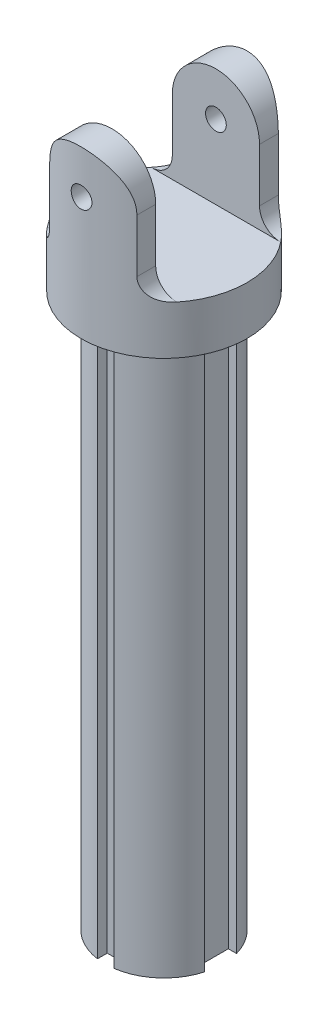
from build123d import *

# Parameters (mm, degrees)
SKETCH1_R               = 6
BOSS_EXTRUDE1_DEPTH     = 12
CUT_EXTRUDE1_DEPTH      = 15.696938457
CUT_EXTRUDE1_DEPTH_BACK = 15.696938457
SKETCH2_W               = 7.5
SKETCH2_H               = 8.5
CUT_EXTRUDE2_DEPTH      = 15.696938457
CUT_EXTRUDE2_DEPTH_BACK = 15.696938457
SKETCH3_R               = 0.75
BOSS_EXTRUDE2_DEPTH     = 40


with BuildPart() as part:
    # Sketch1 → Boss-Extrude1 (new body)
    with BuildSketch(Plane(origin=(0, 0, 0), x_dir=(1, 0, 0), z_dir=(0, 1, 0))):
        with Locations(Location((0, 0, 0), (0, 0, 270))):
            Circle(SKETCH1_R)
    extrude(amount=BOSS_EXTRUDE1_DEPTH)

    # Sketch2 → Cut-Extrude1 (cut, two sides: drawn at the far end of the back side and taken through both)
    with BuildSketch(Plane(origin=(0, 0, 0), x_dir=(0, 0, -1), z_dir=(1, 0, 0)).offset(-CUT_EXTRUDE1_DEPTH_BACK)):
        with Locations((0, 7.75)):
            Rectangle(SKETCH2_W, SKETCH2_H)
    extrude(amount=CUT_EXTRUDE1_DEPTH + CUT_EXTRUDE1_DEPTH_BACK, mode=Mode.SUBTRACT)

    # Sketch3 → Cut-Extrude2 (cut, two sides: drawn at the far end of the back side and taken through both)
    with BuildSketch(Plane.XY.offset(-CUT_EXTRUDE2_DEPTH_BACK)):
        with BuildLine():
            Line((-3.15, 5), (-3.15, 8.85))
            ThreePointArc((-3.15, 8.85), (-2.227386361, 11.077386361), (0, 12))
            Line((0, 12), (-4.683748499, 12))
            Line((-4.683748499, 12), (-4.683748499, 3.5))
            Line((-4.683748499, 3.5), (-4.65, 3.5))
            ThreePointArc((-4.65, 3.5), (-3.589339828, 3.939339828), (-3.15, 5))
        make_face()
        with BuildLine():
            Line((4.683748499, 12), (0, 12))
            ThreePointArc((0, 12), (2.227386361, 11.077386361), (3.15, 8.85))
            Line((3.15, 8.85), (3.15, 5))
            ThreePointArc((3.15, 5), (3.589339828, 3.939339828), (4.65, 3.5))
            Line((4.65, 3.5), (4.683748499, 3.5))
            Line((4.683748499, 3.5), (4.683748499, 12))
        make_face()
        with Locations((0, 8.85)):
            Circle(SKETCH3_R)
    extrude(amount=CUT_EXTRUDE2_DEPTH + CUT_EXTRUDE2_DEPTH_BACK, mode=Mode.SUBTRACT)

    # Sketch4 → Boss-Extrude2 (add)
    with BuildSketch(Plane.XZ):
        with BuildLine():
            Line((-0.6, 3.5), (-0.6, 4.207433897))
            ThreePointArc((-0.6, 4.207433897), (-2.799894973, 3.19735643), (-4.091454509, 1.15))
            Line((-4.091454509, 1.15), (-3.5, 1.15))
            Line((-3.5, 1.15), (-3.5, -1.15))
            Line((-3.5, -1.15), (-4.091454509, -1.15))
            ThreePointArc((-4.091454509, -1.15), (-2.799894973, -3.19735643), (-0.6, -4.207433897))
            Line((-0.6, -4.207433897), (-0.6, -3.5))
            Line((-0.6, -3.5), (0.6, -3.5))
            Line((0.6, -3.5), (0.6, -4.207433897))
            ThreePointArc((0.6, -4.207433897), (2.799894973, -3.19735643), (4.091454509, -1.15))
            Line((4.091454509, -1.15), (3.5, -1.15))
            Line((3.5, -1.15), (3.5, 1.15))
            Line((3.5, 1.15), (4.091454509, 1.15))
            ThreePointArc((4.091454509, 1.15), (2.799894973, 3.19735643), (0.6, 4.207433897))
            Line((0.6, 4.207433897), (0.6, 3.5))
            Line((0.6, 3.5), (-0.6, 3.5))
        make_face()
    extrude(amount=BOSS_EXTRUDE2_DEPTH)


solid = part.part
